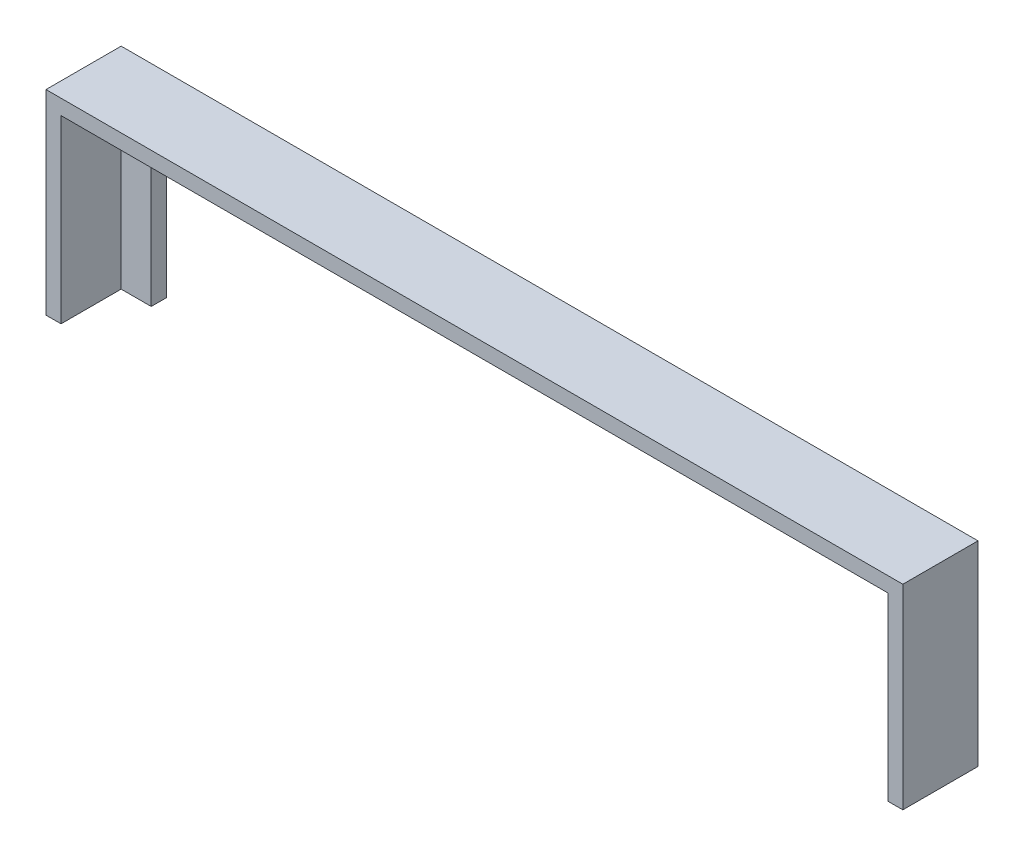
from build123d import *

# Parameters (mm, degrees)
SALIENTE_EXTRUIR1_DEPTH = 5
CORTAR_EXTRUIR1_DEPTH   = 4


with BuildPart() as part:
    # Croquis1 → Saliente-Extruir1 (new body)
    with BuildSketch(Plane.XY):
        Polygon((-71.841407148, -5.708328863), (-71.841407148, 4.291671137), (-20.841407148, 4.291671137), (-20.841407148, -5.708328863), (-17.841407148, -5.708328863), (-17.841407148, 7.291671137), (-74.841407148, 7.291671137), (-74.841407148, -5.708328863), align=None)
    extrude(amount=SALIENTE_EXTRUIR1_DEPTH)

    # Croquis2 → Cortar-Extruir1 (cut)
    with BuildSketch(Plane.XY.offset(5)):
        Polygon((-71.841407148, -5.708328863), (-73.841407148, -5.708328863), (-73.841407148, 6.291671137), (-18.841407148, 6.291671137), (-18.841407148, -5.708328863), (-20.841407148, -5.708328863), (-20.841407148, 4.291671137), (-71.841407148, 4.291671137), align=None)
    extrude(amount=-CORTAR_EXTRUIR1_DEPTH, mode=Mode.SUBTRACT)


solid = part.part
